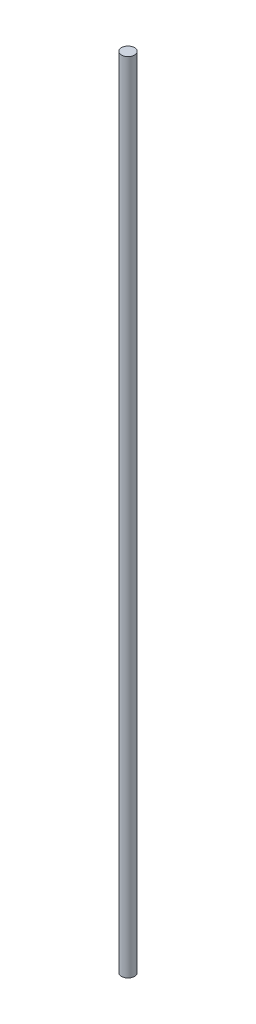
from build123d import *

# Parameters (mm, degrees)
CROQUIS5_R              = 3
SALIENTE_EXTRUIR3_DEPTH = 184


with BuildPart() as part:
    # Croquis5 → Saliente-Extruir3 (new, symmetric)
    with BuildSketch(Plane(origin=(0, 0, 0), x_dir=(1, 0, 0), z_dir=(0, 1, 0))):
        with Locations(Location((0, 0, 0), (0, 0, 270))):
            Circle(CROQUIS5_R)
    extrude(amount=SALIENTE_EXTRUIR3_DEPTH, both=True)


solid = part.part
